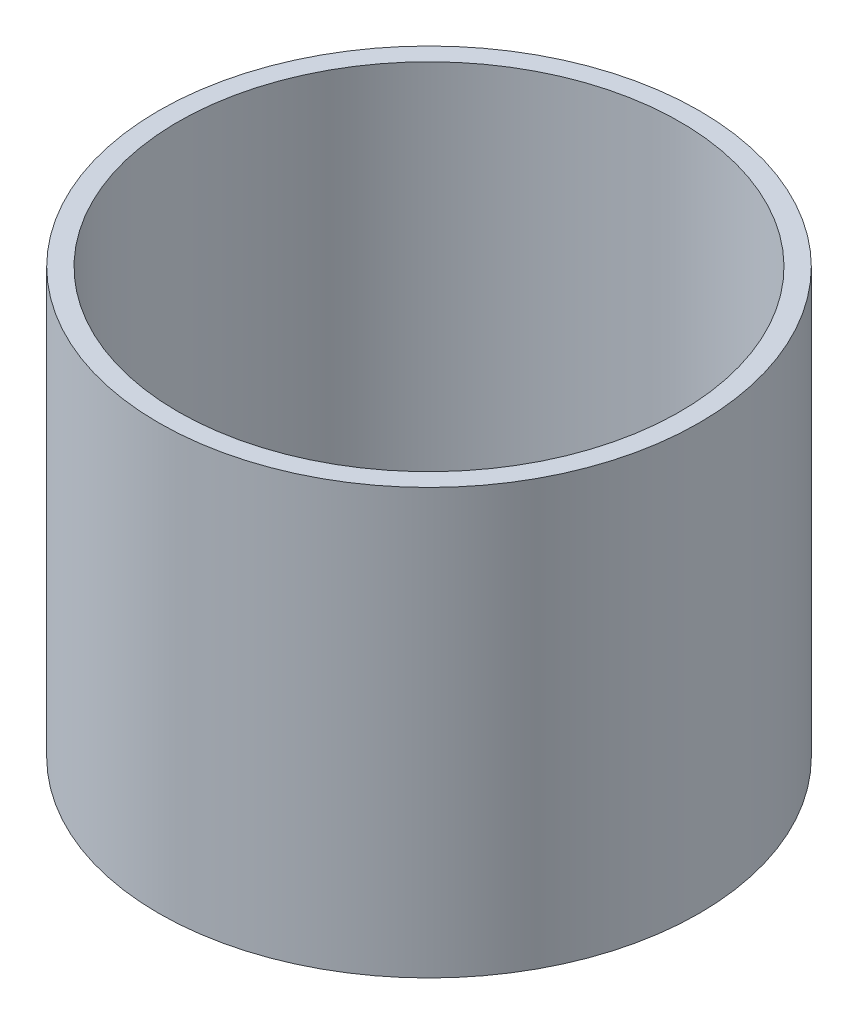
from build123d import *

# Parameters (mm, degrees)
SKETCH1_R           = 17.78
BOSS_EXTRUDE1_DEPTH = 27.94
SKETCH2_R           = 16.51
CUT_EXTRUDE1_DEPTH  = 38.588567411


with BuildPart() as part:
    # Sketch1 → Boss-Extrude1 (new body)
    with BuildSketch(Plane(origin=(0, 0, 0), x_dir=(1, 0, 0), z_dir=(0, 1, 0))):
        with Locations(Location((0, 0, 0), (0, 0, 270))):
            Circle(SKETCH1_R)
    extrude(amount=BOSS_EXTRUDE1_DEPTH)

    # Sketch2 → Cut-Extrude1 (cut, through all)
    with BuildSketch(Plane(origin=(0, 27.94, 0), x_dir=(1, 0, 0), z_dir=(0, 1, 0))):
        with Locations(Location((0, 0, 0), (0, 0, 270))):
            Circle(SKETCH2_R)
    extrude(amount=-CUT_EXTRUDE1_DEPTH, mode=Mode.SUBTRACT)


solid = part.part
